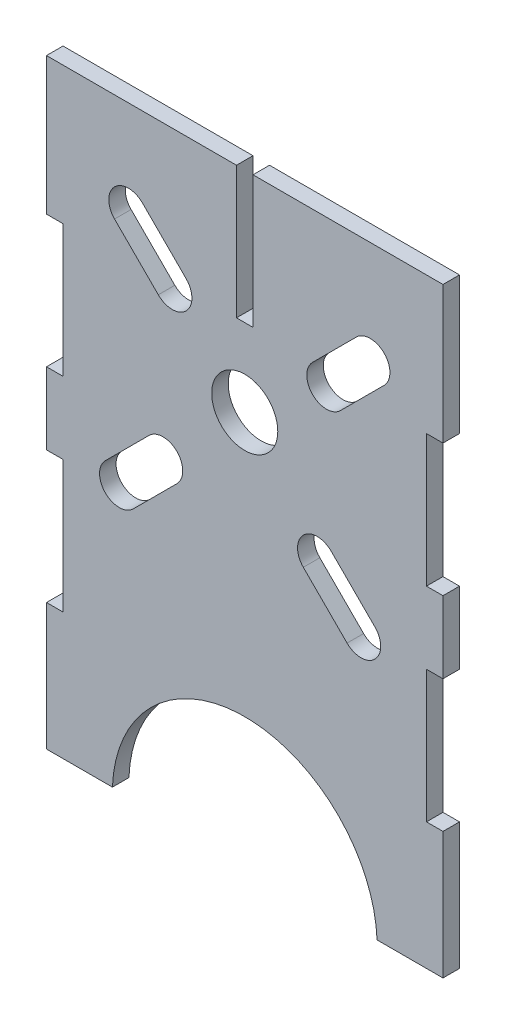
from build123d import *

# Parameters (mm, degrees)
SKETCH9_R           = 6.35
BOSS_EXTRUDE3_DEPTH = 3.175


with BuildPart() as part:
    # Sketch9 → Boss-Extrude3 (new body)
    with BuildSketch(Plane.XY.offset(-50.8)):
        with BuildLine():
            Line((1.5875, 14.934655528), (-1.5875, 14.934655528))
            Line((-1.5875, 14.934655528), (-1.5875, 40.334655528))
            Line((-1.5875, 40.334655528), (-38.1, 40.334655528))
            Line((-38.1, 40.334655528), (-38.1, 13.934655528))
            Line((-38.1, 13.934655528), (-34.925, 13.934655528))
            Line((-34.925, 13.934655528), (-34.925, -11.465344472))
            Line((-34.925, -11.465344472), (-38.1, -11.465344472))
            Line((-38.1, -11.465344472), (-38.1, -25.296741856))
            Line((-38.1, -25.296741856), (-34.925, -25.296741856))
            Line((-34.925, -25.296741856), (-34.925, -50.696741856))
            Line((-34.925, -50.696741856), (-38.1, -50.696741856))
            Line((-38.1, -50.696741856), (-38.1, -75.096741856))
            Line((-38.1, -75.096741856), (-25.429906729, -75.096741856))
            ThreePointArc((-25.429906729, -75.096741856), (0, -50.647180833), (25.429906729, -75.096741856))
            Line((25.429906729, -75.096741856), (38.1, -75.096741856))
            Line((38.1, -75.096741856), (38.1, -50.696741856))
            Line((38.1, -50.696741856), (34.925, -50.696741856))
            Line((34.925, -50.696741856), (34.925, -25.296741856))
            Line((34.925, -25.296741856), (38.1, -25.296741856))
            Line((38.1, -25.296741856), (38.1, -11.465344472))
            Line((38.1, -11.465344472), (34.925, -11.465344472))
            Line((34.925, -11.465344472), (34.925, 13.934655528))
            Line((34.925, 13.934655528), (38.1, 13.934655528))
            Line((38.1, 13.934655528), (38.1, 40.334655528))
            Line((38.1, 40.334655528), (1.5875, 40.334655528))
            Line((1.5875, 40.334655528), (1.5875, 14.934655528))
        make_face()
        with BuildLine():
            ThreePointArc((-21.440764859, -26.794960108), (-26.794960108, -26.794960108), (-26.794960108, -21.440764859))
            Line((-26.794960108, -21.440764859), (-18.385728243, -13.031532993))
            ThreePointArc((-18.385728243, -13.031532993), (-13.031532993, -13.031532993), (-13.031532993, -18.385728243))
            Line((-13.031532993, -18.385728243), (-21.440764859, -26.794960108))
        make_face(mode=Mode.SUBTRACT)
        with BuildLine():
            ThreePointArc((25.020985018, -23.214739949), (25.020985018, -28.568935198), (19.666789768, -28.568935198))
            Line((19.666789768, -28.568935198), (11.257557903, -20.159703333))
            ThreePointArc((11.257557903, -20.159703333), (11.257557903, -14.805508084), (16.611753152, -14.805508084))
            Line((16.611753152, -14.805508084), (25.020985018, -23.214739949))
        make_face(mode=Mode.SUBTRACT)
        with BuildLine():
            ThreePointArc((-25.020985018, 19.666789768), (-25.020985018, 25.020985018), (-19.666789768, 25.020985018))
            Line((-19.666789768, 25.020985018), (-11.257557903, 16.611753152))
            ThreePointArc((-11.257557903, 16.611753152), (-11.257557903, 11.257557903), (-16.611753152, 11.257557903))
            Line((-16.611753152, 11.257557903), (-25.020985018, 19.666789768))
        make_face(mode=Mode.SUBTRACT)
        Circle(SKETCH9_R, mode=Mode.SUBTRACT)
        with BuildLine():
            ThreePointArc((21.440764859, 23.247009927), (26.794960108, 23.247009927), (26.794960108, 17.892814678))
            Line((26.794960108, 17.892814678), (18.385728243, 9.483582813))
            ThreePointArc((18.385728243, 9.483582813), (13.031532993, 9.483582813), (13.031532993, 14.837778062))
            Line((13.031532993, 14.837778062), (21.440764859, 23.247009927))
        make_face(mode=Mode.SUBTRACT)
    extrude(amount=-BOSS_EXTRUDE3_DEPTH)


solid = part.part
